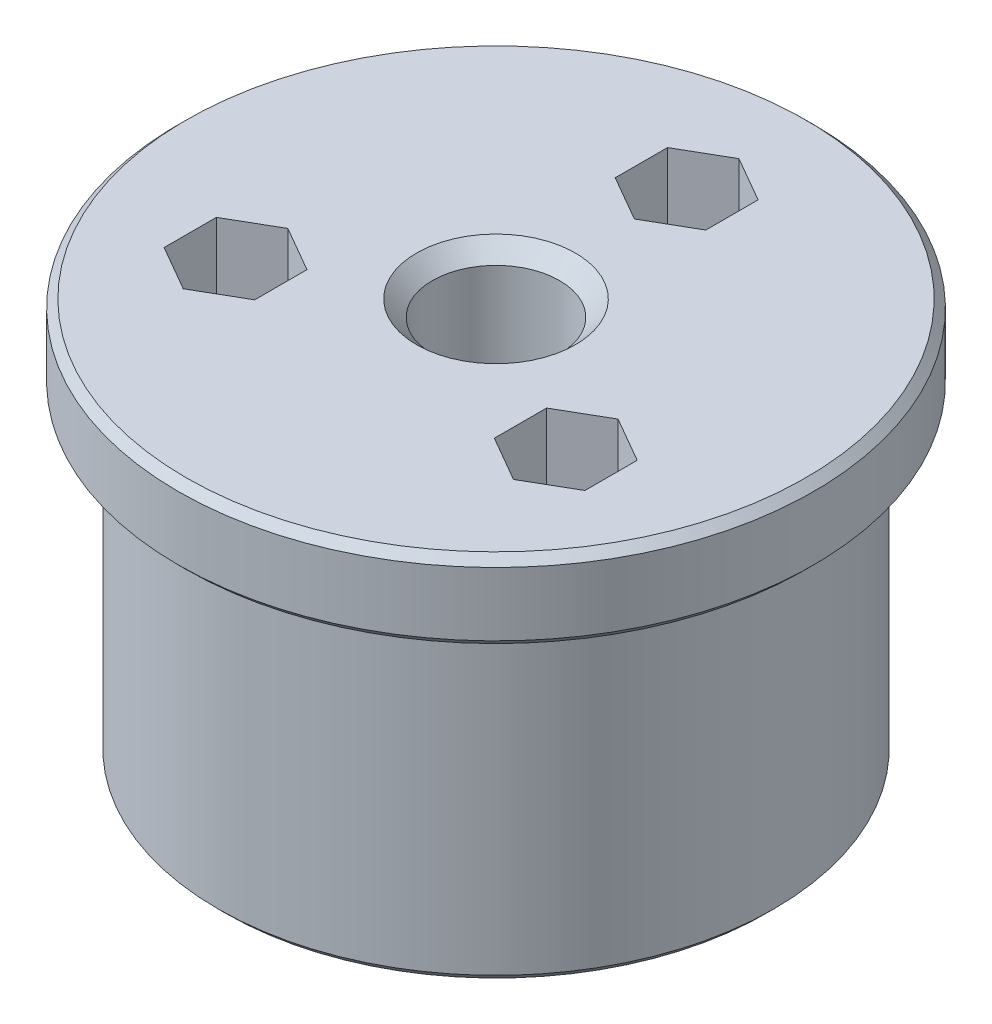
from build123d import *

# Parameters (mm, degrees)
SKETCH_1_R               = 20
EXTRUDE_1_DEPTH          = 25
SKETCH_2_OUTSIDE_W       = 54.37
SKETCH_2_OUTSIDE_H       = 54.37
SKETCH_2_OUTSIDE_R       = 17.5
CUT_EXTRUDE_1_DEPTH      = 20
SKETCH_3_R               = 15.1
CUT_EXTRUDE_2_DEPTH      = 6
SKETCH_4_R               = 4
CUT_EXTRUDE_3_DEPTH      = 38.749172176
SKETCH_4_3_R             = 1.6
CUT_EXTRUDE_4_DEPTH      = 38.749172176
CUT_EXTRUDE_START        = 15
SKETCH_4_4_R             = 1.6
CUT_EXTRUDE_5_DEPTH      = 23.749172176
PATTERN_CIRCULAR_1_COUNT = 3
CHAMFER_1_SIZE           = 0.5
CHAMFER_2_SIZE           = 1
FILLET_1_R               = 0.6


with BuildPart() as part:
    # Эскиз1 → Бобышка-Вытянуть1 (new body)
    with BuildSketch(Plane(origin=(0, 0, 0), x_dir=(1, 0, 0), z_dir=(0, 1, 0))):
        Circle(SKETCH_1_R)
    extrude(amount=EXTRUDE_1_DEPTH)

    # Эскиз2 outside → Вырез-Вытянуть1 (cut)
    with BuildSketch(Plane(origin=(0, 0, 0), x_dir=(1, 0, 0), z_dir=(0, 1, 0))):
        Rectangle(SKETCH_2_OUTSIDE_W, SKETCH_2_OUTSIDE_H)
        Circle(SKETCH_2_OUTSIDE_R, mode=Mode.SUBTRACT)
    extrude(amount=CUT_EXTRUDE_1_DEPTH, mode=Mode.SUBTRACT)

    # Эскиз3 → Вырез-Вытянуть2 (cut)
    with BuildSketch(Plane.XZ):
        Circle(SKETCH_3_R)
    extrude(amount=-CUT_EXTRUDE_2_DEPTH, mode=Mode.SUBTRACT)

    # Эскиз4 → Вырез-Вытянуть3 (cut, through all)
    with BuildSketch(Plane(origin=(0, 0, 0), x_dir=(1, 0, 0), z_dir=(0, 1, 0))):
        Circle(SKETCH_4_R)
    extrude(amount=CUT_EXTRUDE_3_DEPTH, mode=Mode.SUBTRACT)

    # Эскиз4<3> → Вырез-Вытянуть4 (cut, through all)
    with BuildSketch(Plane(origin=(0, 0, 0), x_dir=(1, 0, 0), z_dir=(0, 1, 0))):
        with Locations((0, 12)):
            Circle(SKETCH_4_3_R)
    cut_extrude_4 = extrude(amount=CUT_EXTRUDE_4_DEPTH, mode=Mode.SUBTRACT)

    # Эскиз4<4> → Вырез-Вытянуть5 (cut, through all)
    with BuildSketch(Plane(origin=(0, 0, 0), x_dir=(1, 0, 0), z_dir=(0, 1, 0)).offset(CUT_EXTRUDE_START)):
        Polygon((2.85, 13.645448267), (0, 15.290896534), (-2.85, 13.645448267), (-2.85, 10.354551733), (0, 8.709103466), (2.85, 10.354551733), align=None)
        with Locations((0, 12)):
            Circle(SKETCH_4_4_R, mode=Mode.SUBTRACT)
    cut_extrude_5 = extrude(amount=CUT_EXTRUDE_5_DEPTH, mode=Mode.SUBTRACT)

    # Круговой массив1: Вырез-Вытянуть4, Вырез-Вытянуть5 ×3 about axis
    pattern_circular_1_axis = Axis((0, 20, 0), (0, -1, 0))
    add([cut_extrude_4.rotate(pattern_circular_1_axis, i * 360 / PATTERN_CIRCULAR_1_COUNT) for i in range(1, PATTERN_CIRCULAR_1_COUNT)], mode=Mode.SUBTRACT)
    add([cut_extrude_5.rotate(pattern_circular_1_axis, i * 360 / PATTERN_CIRCULAR_1_COUNT) for i in range(1, PATTERN_CIRCULAR_1_COUNT)], mode=Mode.SUBTRACT)

    # Фаска1
    chamfer_1_edges = [part.edges().sort_by_distance(p)[0] for p in [
        (-20, 25, 0),
        (-20, 20, 0),
        (-17.5, 0, 0),
    ]]
    chamfer(chamfer_1_edges, length=CHAMFER_1_SIZE)

    # Фаска2
    chamfer_2_edges = [part.edges().sort_by_distance(p)[0] for p in [
        (-4, 25, 0),
        (-4, 6, 0),
    ]]
    chamfer(chamfer_2_edges, length=CHAMFER_2_SIZE)

    # Скругление1
    fillet_1_edges = [part.edges().sort_by_distance(p)[0] for p in [
        (-15.1, 6, 0),
    ]]
    fillet(fillet_1_edges, radius=FILLET_1_R)


solid = part.part
